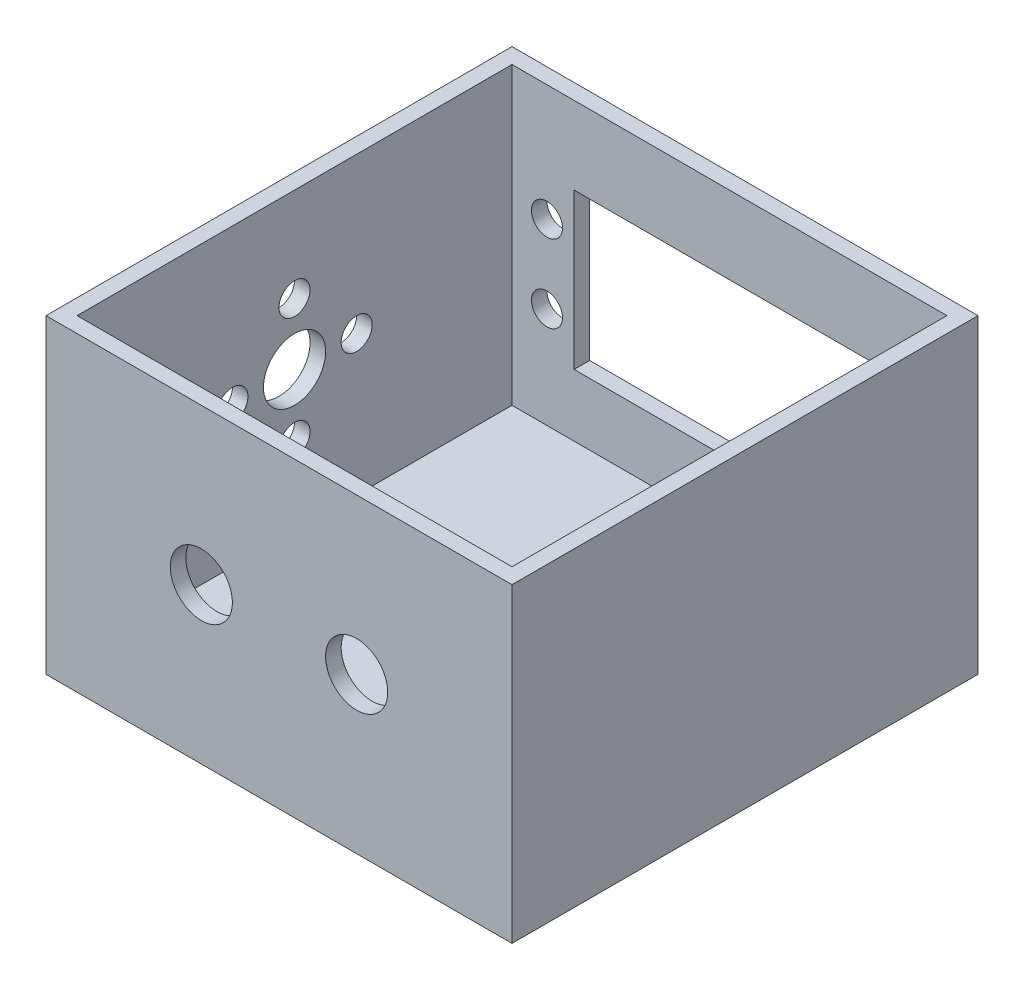
from build123d import *

# Parameters (mm, degrees)
IZIM2_W                     = 60
IZIM2_H                     = 40
Y_KSEKLIK_EKSTR_ZYON1_DEPTH = 60
BO_ALTMA1_T                 = -2
KES_EKSTR_ZYON2_REACH       = 95.808
IZIM4_R                     = 2
IZIM4_W                     = 40
IZIM4_H                     = 20
KES_EKSTR_ZYON3_REACH       = 95.808
IZIM5_R                     = 2
KES_EKSTR_ZYON4_REACH       = 95.808
IZIM6_R                     = 4
KES_EKSTR_ZYON5_REACH       = 95.808
IZIM7_R                     = 4
IZIM7_R_2                   = 2


with BuildPart() as part:
    # Çizim2 → Yükseklik-Ekstrüzyon1 (new body)
    with BuildSketch(Plane.XY):
        with Locations((30, 20)):
            Rectangle(IZIM2_W, IZIM2_H)
    extrude(amount=Y_KSEKLIK_EKSTR_ZYON1_DEPTH)

    # İç Boşaltma1
    bo_altma1_openings = [part.faces().sort_by_distance(p)[0] for p in [
        (30, 40, 30),
    ]]
    offset(amount=BO_ALTMA1_T, openings=bo_altma1_openings, kind=Kind.INTERSECTION)

    # Çizim4 → Kes-Ekstrüzyon2 (cut, up to next)
    with BuildSketch(Plane(origin=(0, 0, 0), x_dir=(-1, 0, 0), z_dir=(0, 0, -1)), mode=Mode.PRIVATE) as kes_ekstr_zyon2_sk1:
        with Locations((-53.5, 25)):
            Circle(IZIM4_R)
    kes_ekstr_zyon2_tool1 = extrude(kes_ekstr_zyon2_sk1.sketch, amount=-KES_EKSTR_ZYON2_REACH, mode=Mode.PRIVATE) & part.part
    # Çizim4 → Kes-Ekstrüzyon2 (cut, up to next)
    with BuildSketch(Plane(origin=(0, 0, 0), x_dir=(-1, 0, 0), z_dir=(0, 0, -1)), mode=Mode.PRIVATE) as kes_ekstr_zyon2_sk2:
        with Locations((-53.5, 15)):
            Circle(IZIM4_R)
    kes_ekstr_zyon2_tool2 = extrude(kes_ekstr_zyon2_sk2.sketch, amount=-KES_EKSTR_ZYON2_REACH, mode=Mode.PRIVATE) & part.part
    # Çizim4 → Kes-Ekstrüzyon2 (cut, up to next)
    with BuildSketch(Plane(origin=(0, 0, 0), x_dir=(-1, 0, 0), z_dir=(0, 0, -1)), mode=Mode.PRIVATE) as kes_ekstr_zyon2_sk3:
        with Locations((-6.5, 15)):
            Circle(IZIM4_R)
    kes_ekstr_zyon2_tool3 = extrude(kes_ekstr_zyon2_sk3.sketch, amount=-KES_EKSTR_ZYON2_REACH, mode=Mode.PRIVATE) & part.part
    # Çizim4 → Kes-Ekstrüzyon2 (cut, up to next)
    with BuildSketch(Plane(origin=(0, 0, 0), x_dir=(-1, 0, 0), z_dir=(0, 0, -1)), mode=Mode.PRIVATE) as kes_ekstr_zyon2_sk4:
        with Locations((-6.5, 25)):
            Circle(IZIM4_R)
    kes_ekstr_zyon2_tool4 = extrude(kes_ekstr_zyon2_sk4.sketch, amount=-KES_EKSTR_ZYON2_REACH, mode=Mode.PRIVATE) & part.part
    # Çizim4 → Kes-Ekstrüzyon2 (cut, up to next)
    with BuildSketch(Plane(origin=(0, 0, 0), x_dir=(-1, 0, 0), z_dir=(0, 0, -1)), mode=Mode.PRIVATE) as kes_ekstr_zyon2_sk5:
        with Locations((-30, 20)):
            Rectangle(IZIM4_W, IZIM4_H)
    kes_ekstr_zyon2_tool5 = extrude(kes_ekstr_zyon2_sk5.sketch, amount=-KES_EKSTR_ZYON2_REACH, mode=Mode.PRIVATE) & part.part
    add(kes_ekstr_zyon2_tool1.solids().sort_by_distance((53.5, 25, 0))[0], mode=Mode.SUBTRACT)
    add(kes_ekstr_zyon2_tool2.solids().sort_by_distance((53.5, 15, 0))[0], mode=Mode.SUBTRACT)
    add(kes_ekstr_zyon2_tool3.solids().sort_by_distance((6.5, 15, 0))[0], mode=Mode.SUBTRACT)
    add(kes_ekstr_zyon2_tool4.solids().sort_by_distance((6.5, 25, 0))[0], mode=Mode.SUBTRACT)
    add(kes_ekstr_zyon2_tool5.solids().sort_by_distance((30, 20, 0))[0], mode=Mode.SUBTRACT)

    # Çizim5 → Kes-Ekstrüzyon3 (cut, up to next)
    with BuildSketch(Plane.XZ, mode=Mode.PRIVATE) as kes_ekstr_zyon3_sk1:
        with Locations(Location((30, 30, 0), (0, 0, 270))):
            Circle(IZIM5_R)
    kes_ekstr_zyon3_tool1 = extrude(kes_ekstr_zyon3_sk1.sketch, amount=-KES_EKSTR_ZYON3_REACH, mode=Mode.PRIVATE) & part.part
    # Çizim5 → Kes-Ekstrüzyon3 (cut, up to next)
    with BuildSketch(Plane.XZ, mode=Mode.PRIVATE) as kes_ekstr_zyon3_sk2:
        with Locations(Location((38, 30, 0), (0, 0, 270))):
            Circle(IZIM5_R)
    kes_ekstr_zyon3_tool2 = extrude(kes_ekstr_zyon3_sk2.sketch, amount=-KES_EKSTR_ZYON3_REACH, mode=Mode.PRIVATE) & part.part
    # Çizim5 → Kes-Ekstrüzyon3 (cut, up to next)
    with BuildSketch(Plane.XZ, mode=Mode.PRIVATE) as kes_ekstr_zyon3_sk3:
        with Locations(Location((30, 38, 0), (0, 0, 270))):
            Circle(IZIM5_R)
    kes_ekstr_zyon3_tool3 = extrude(kes_ekstr_zyon3_sk3.sketch, amount=-KES_EKSTR_ZYON3_REACH, mode=Mode.PRIVATE) & part.part
    # Çizim5 → Kes-Ekstrüzyon3 (cut, up to next)
    with BuildSketch(Plane.XZ, mode=Mode.PRIVATE) as kes_ekstr_zyon3_sk4:
        with Locations(Location((30, 22, 0), (0, 0, 90))):
            Circle(IZIM5_R)
    kes_ekstr_zyon3_tool4 = extrude(kes_ekstr_zyon3_sk4.sketch, amount=-KES_EKSTR_ZYON3_REACH, mode=Mode.PRIVATE) & part.part
    # Çizim5 → Kes-Ekstrüzyon3 (cut, up to next)
    with BuildSketch(Plane.XZ, mode=Mode.PRIVATE) as kes_ekstr_zyon3_sk5:
        with Locations(Location((22, 30, 0), (0, 0, 90))):
            Circle(IZIM5_R)
    kes_ekstr_zyon3_tool5 = extrude(kes_ekstr_zyon3_sk5.sketch, amount=-KES_EKSTR_ZYON3_REACH, mode=Mode.PRIVATE) & part.part
    add(kes_ekstr_zyon3_tool1.solids().sort_by_distance((30, 0, 30))[0], mode=Mode.SUBTRACT)
    add(kes_ekstr_zyon3_tool2.solids().sort_by_distance((38, 0, 30))[0], mode=Mode.SUBTRACT)
    add(kes_ekstr_zyon3_tool3.solids().sort_by_distance((30, 0, 38))[0], mode=Mode.SUBTRACT)
    add(kes_ekstr_zyon3_tool4.solids().sort_by_distance((30, 0, 22))[0], mode=Mode.SUBTRACT)
    add(kes_ekstr_zyon3_tool5.solids().sort_by_distance((22, 0, 30))[0], mode=Mode.SUBTRACT)

    # Çizim6 → Kes-Ekstrüzyon4 (cut, up to next)
    with BuildSketch(Plane.XY.offset(60), mode=Mode.PRIVATE) as kes_ekstr_zyon4_sk1:
        with Locations((20, 20)):
            Circle(IZIM6_R)
    kes_ekstr_zyon4_tool1 = extrude(kes_ekstr_zyon4_sk1.sketch, amount=-KES_EKSTR_ZYON4_REACH, mode=Mode.PRIVATE) & part.part
    # Çizim6 → Kes-Ekstrüzyon4 (cut, up to next)
    with BuildSketch(Plane.XY.offset(60), mode=Mode.PRIVATE) as kes_ekstr_zyon4_sk2:
        with Locations(Location((40, 20, 0), (0, 0, 180))):
            Circle(IZIM6_R)
    kes_ekstr_zyon4_tool2 = extrude(kes_ekstr_zyon4_sk2.sketch, amount=-KES_EKSTR_ZYON4_REACH, mode=Mode.PRIVATE) & part.part
    add(kes_ekstr_zyon4_tool1.solids().sort_by_distance((20, 20, 60))[0], mode=Mode.SUBTRACT)
    add(kes_ekstr_zyon4_tool2.solids().sort_by_distance((40, 20, 60))[0], mode=Mode.SUBTRACT)

    # Çizim7 → Kes-Ekstrüzyon5 (cut, up to next)
    with BuildSketch(Plane.ZY, mode=Mode.PRIVATE) as kes_ekstr_zyon5_sk1:
        with Locations((30, 20)):
            Circle(IZIM7_R)
    kes_ekstr_zyon5_tool1 = extrude(kes_ekstr_zyon5_sk1.sketch, amount=-KES_EKSTR_ZYON5_REACH, mode=Mode.PRIVATE) & part.part
    # Çizim7 → Kes-Ekstrüzyon5 (cut, up to next)
    with BuildSketch(Plane.ZY, mode=Mode.PRIVATE) as kes_ekstr_zyon5_sk2:
        with Locations((22, 20)):
            Circle(IZIM7_R_2)
    kes_ekstr_zyon5_tool2 = extrude(kes_ekstr_zyon5_sk2.sketch, amount=-KES_EKSTR_ZYON5_REACH, mode=Mode.PRIVATE) & part.part
    # Çizim7 → Kes-Ekstrüzyon5 (cut, up to next)
    with BuildSketch(Plane.ZY, mode=Mode.PRIVATE) as kes_ekstr_zyon5_sk3:
        with Locations(Location((38, 20, 0), (0, 0, 180))):
            Circle(IZIM7_R_2)
    kes_ekstr_zyon5_tool3 = extrude(kes_ekstr_zyon5_sk3.sketch, amount=-KES_EKSTR_ZYON5_REACH, mode=Mode.PRIVATE) & part.part
    # Çizim7 → Kes-Ekstrüzyon5 (cut, up to next)
    with BuildSketch(Plane.ZY, mode=Mode.PRIVATE) as kes_ekstr_zyon5_sk4:
        with Locations((30, 27.898318077)):
            Circle(IZIM7_R_2)
    kes_ekstr_zyon5_tool4 = extrude(kes_ekstr_zyon5_sk4.sketch, amount=-KES_EKSTR_ZYON5_REACH, mode=Mode.PRIVATE) & part.part
    # Çizim7 → Kes-Ekstrüzyon5 (cut, up to next)
    with BuildSketch(Plane.ZY, mode=Mode.PRIVATE) as kes_ekstr_zyon5_sk5:
        with Locations(Location((30, 12.101681923, 0), (0, 0, 180))):
            Circle(IZIM7_R_2)
    kes_ekstr_zyon5_tool5 = extrude(kes_ekstr_zyon5_sk5.sketch, amount=-KES_EKSTR_ZYON5_REACH, mode=Mode.PRIVATE) & part.part
    add(kes_ekstr_zyon5_tool1.solids().sort_by_distance((0, 20, 30))[0], mode=Mode.SUBTRACT)
    add(kes_ekstr_zyon5_tool2.solids().sort_by_distance((0, 20, 22))[0], mode=Mode.SUBTRACT)
    add(kes_ekstr_zyon5_tool3.solids().sort_by_distance((0, 20, 38))[0], mode=Mode.SUBTRACT)
    add(kes_ekstr_zyon5_tool4.solids().sort_by_distance((0, 27.898318, 30))[0], mode=Mode.SUBTRACT)
    add(kes_ekstr_zyon5_tool5.solids().sort_by_distance((0, 12.101682, 30))[0], mode=Mode.SUBTRACT)


solid = part.part
